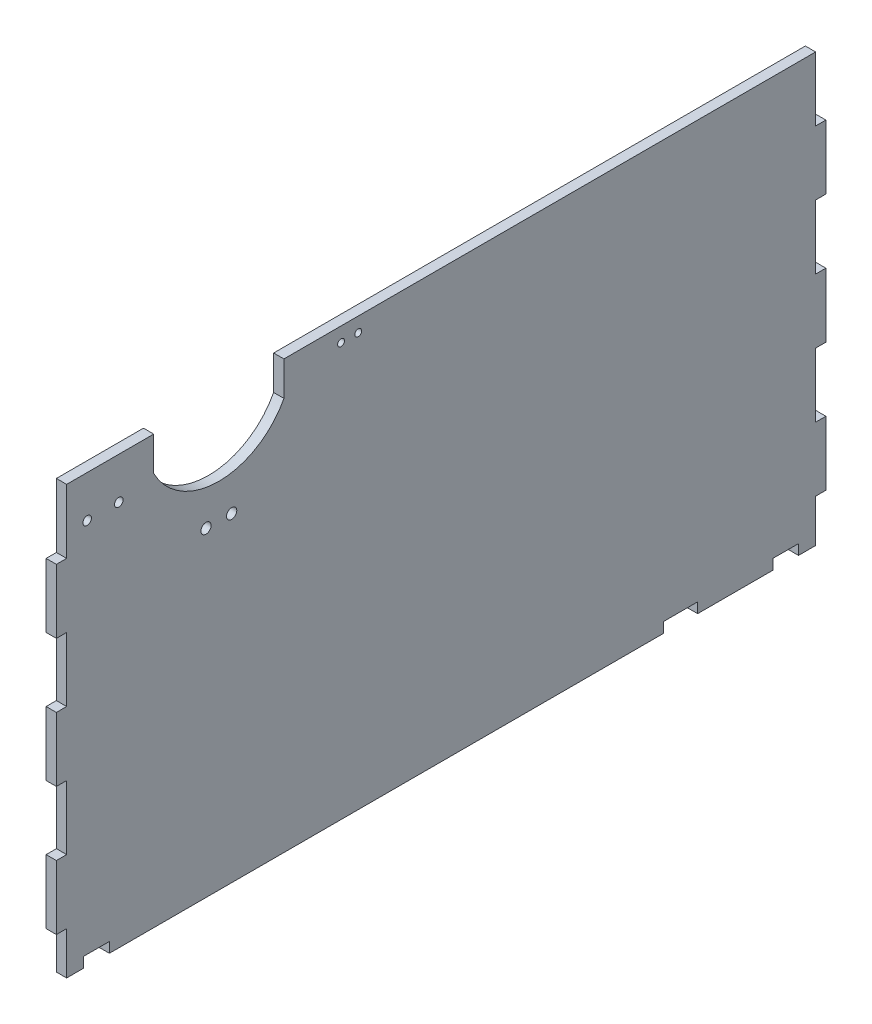
from build123d import *

# Parameters (mm, degrees)
SKETCH1_W            = 450
SKETCH1_H            = 250
BOSS_EXTRUDE1_DEPTH  = 6
SKETCH2_W            = 6
SKETCH2_H            = 37.5
CUT_EXTRUDE1_DEPTH   = 515.816472153
LPATTERN1_COUNT      = 4
LPATTERN1_PITCH      = 75
LPATTERN1_COUNT_DIR2 = 2
LPATTERN1_PITCH_DIR2 = 444
SKETCH3_W            = 15
SKETCH3_H            = 6
CUT_EXTRUDE2_DEPTH   = 515.816472153
LPATTERN2_COUNT      = 2
LPATTERN2_PITCH      = 403
SKETCH4_R            = 3
CUT_EXTRUDE3_DEPTH   = 10
SKETCH5_W            = 20
SKETCH5_H            = 6
CUT_EXTRUDE4_DEPTH   = 515.816472153
SKETCH6_R            = 2.5
SKETCH6_R_2          = 2
CUT_EXTRUDE5_DEPTH   = 515.816472153


with BuildPart() as part:
    # Sketch1 → Boss-Extrude1 (new body)
    with BuildSketch(Plane(origin=(0, 0, 0), x_dir=(0, 0, -1), z_dir=(1, 0, 0))):
        with Locations((-225, 125)):
            Rectangle(SKETCH1_W, SKETCH1_H)
    extrude(amount=BOSS_EXTRUDE1_DEPTH)

    # Sketch2 → Cut-Extrude1 (cut, through all)
    with BuildSketch(Plane(origin=(6, 0, 0), x_dir=(0, 0, -1), z_dir=(1, 0, 0))):
        with Locations((-447, 231.25)):
            Rectangle(SKETCH2_W, SKETCH2_H)
    cut_extrude1 = extrude(amount=-CUT_EXTRUDE1_DEPTH, mode=Mode.SUBTRACT)

    # LPattern1: Cut-Extrude1 4 × 2
    with Locations(*[(0, -i * LPATTERN1_PITCH, -j * LPATTERN1_PITCH_DIR2) for i in range(LPATTERN1_COUNT) for j in range(LPATTERN1_COUNT_DIR2) if (i, j) != (0, 0)]):
        add(cut_extrude1, mode=Mode.SUBTRACT)

    # Sketch3 → Cut-Extrude2 (cut, through all)
    with BuildSketch(Plane(origin=(6, 0, 0), x_dir=(0, 0, -1), z_dir=(1, 0, 0))):
        with Locations((-426.5, 3)):
            Rectangle(SKETCH3_W, SKETCH3_H)
    cut_extrude2 = extrude(amount=-CUT_EXTRUDE2_DEPTH, mode=Mode.SUBTRACT)

    # LPattern2: Cut-Extrude2 ×2
    with Locations(*[(0, 0, -i * LPATTERN2_PITCH) for i in range(1, LPATTERN2_COUNT)]):
        add(cut_extrude2, mode=Mode.SUBTRACT)

    # Sketch4 → Cut-Extrude3 (cut)
    with BuildSketch(Plane(origin=(6, 0, 0), x_dir=(0, 0, -1), z_dir=(1, 0, 0))):
        with Locations((-362.5, 187)):
            Circle(SKETCH4_R)
        with Locations((-347.5, 187)):
            Circle(SKETCH4_R)
        with BuildLine():
            Line((-393.065732621, 230), (-393.065732621, 250))
            Line((-393.065732621, 250), (-316.934267379, 250))
            Line((-316.934267379, 250), (-316.934267379, 230))
            ThreePointArc((-316.934267379, 230), (-355, 207), (-393.065732621, 230))
        make_face()
    extrude(amount=-CUT_EXTRUDE3_DEPTH, mode=Mode.SUBTRACT)

    # Sketch5 → Cut-Extrude4 (cut, through all)
    with BuildSketch(Plane(origin=(6, 0, 0), x_dir=(0, 0, -1), z_dir=(1, 0, 0))):
        with Locations((-85, 3)):
            Rectangle(SKETCH5_W, SKETCH5_H)
    extrude(amount=-CUT_EXTRUDE4_DEPTH, mode=Mode.SUBTRACT)

    # Sketch6 → Cut-Extrude5 (cut, through all)
    with BuildSketch(Plane.ZY):
        with Locations((432, 225.7)):
            Circle(SKETCH6_R)
        with Locations((413.5, 225.7)):
            Circle(SKETCH6_R)
        with Locations((283.51, 241.5)):
            Circle(SKETCH6_R_2)
        with Locations((273.51, 241.5)):
            Circle(SKETCH6_R_2)
    extrude(amount=-CUT_EXTRUDE5_DEPTH, mode=Mode.SUBTRACT)


solid = part.part
